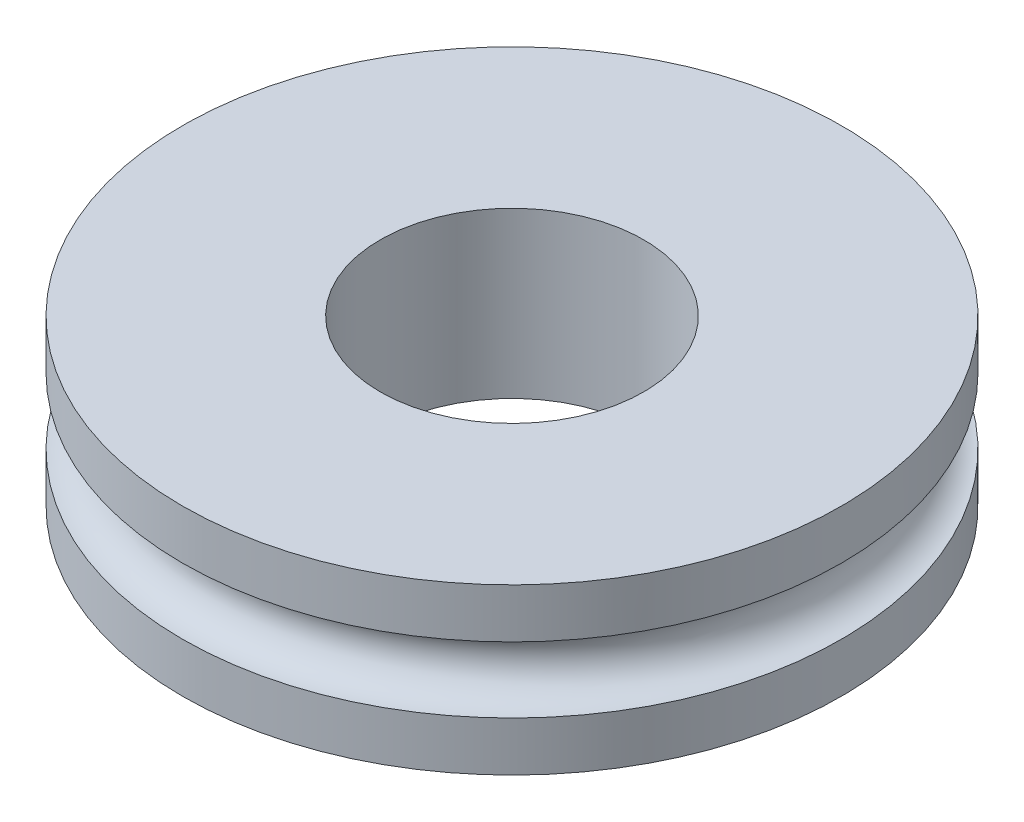
from build123d import *

# Parameters (mm, degrees)
BOSS_EXTRU_1_DEPTH      = 1.25
BOSS_EXTRU_1_DEPTH_BACK = 1.25
ESQUISSE1_R             = 5
ESQUISSE1_R_2           = 2
ESQUISSE2_R             = 0.5


with BuildPart() as part:
    # Esquisse1 → Boss.-Extru.1 (new, two sides: drawn at the far end of the back side and taken through both)
    with BuildSketch(Plane(origin=(0, 0, 0), x_dir=(1, 0, 0), z_dir=(0, 1, 0)).offset(-BOSS_EXTRU_1_DEPTH_BACK)):
        Circle(ESQUISSE1_R)
        Circle(ESQUISSE1_R_2, mode=Mode.SUBTRACT)
    extrude(amount=BOSS_EXTRU_1_DEPTH + BOSS_EXTRU_1_DEPTH_BACK)

    # Esquisse2 → Enlèvement de matière-Révolution1 (revolve, cut)
    with BuildSketch(Plane.XY):
        with Locations((5, 0)):
            Circle(ESQUISSE2_R)
    revolve(axis=Axis((0, -3.424000982, 0), (0, 1, 0)), mode=Mode.SUBTRACT)


solid = part.part
